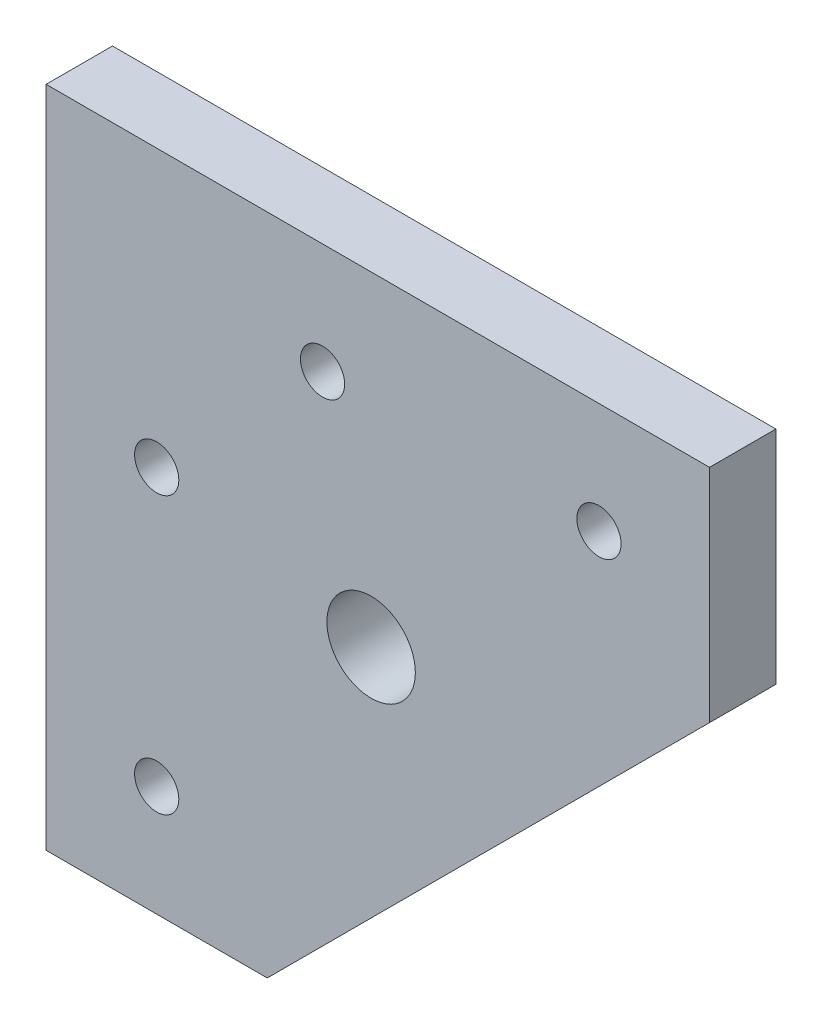
from build123d import *

# Parameters (mm, degrees)
SKETCH1_R           = 2
SKETCH1_R_2         = 4
BOSS_EXTRUDE1_DEPTH = 6


with BuildPart() as part:
    # Sketch1 → Boss-Extrude1 (new body)
    with BuildSketch(Plane.XY):
        Polygon((20, -60), (60, -20), (60, 0), (0, 0), (0, -60), align=None)
        with Locations((50, -10)):
            Circle(SKETCH1_R, mode=Mode.SUBTRACT)
        with Locations((25, -10)):
            Circle(SKETCH1_R, mode=Mode.SUBTRACT)
        with Locations((10, -50)):
            Circle(SKETCH1_R, mode=Mode.SUBTRACT)
        with Locations((10, -25)):
            Circle(SKETCH1_R, mode=Mode.SUBTRACT)
        with Locations((29.393398282, -29.393398282)):
            Circle(SKETCH1_R_2, mode=Mode.SUBTRACT)
    extrude(amount=BOSS_EXTRUDE1_DEPTH)


solid = part.part
